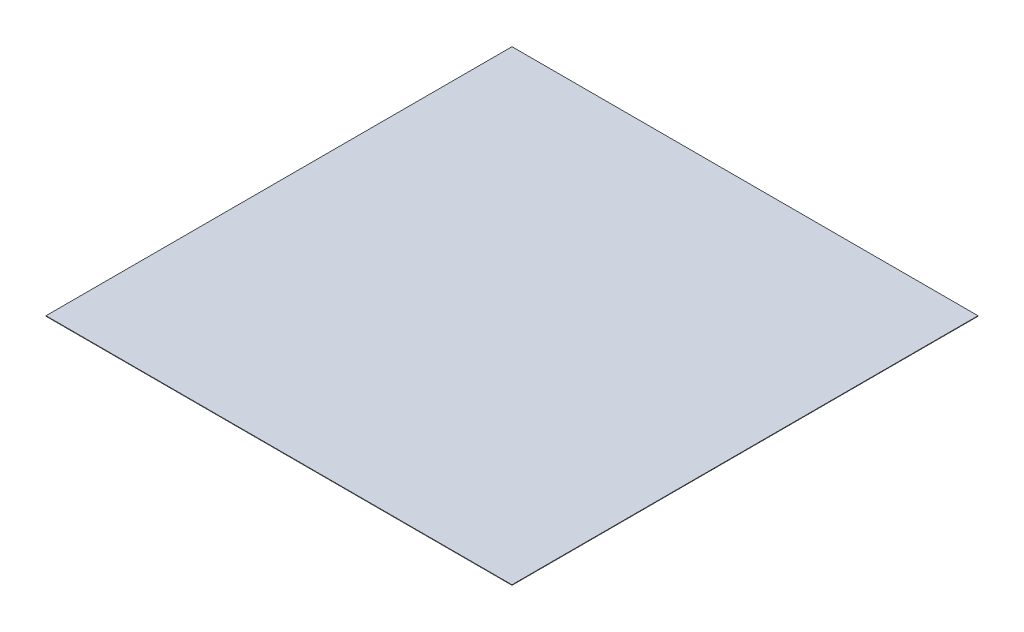
from build123d import *

# Parameters (mm, degrees)
SKETCH1_W           = 1240
SKETCH1_H           = 1240
BOSS_EXTRUDE1_DEPTH = 1.27


with BuildPart() as part:
    # Sketch1 → Boss-Extrude1 (new body)
    with BuildSketch(Plane(origin=(0, 0, 0), x_dir=(1, 0, 0), z_dir=(0, 1, 0))):
        Rectangle(SKETCH1_W, SKETCH1_H)
    extrude(amount=BOSS_EXTRUDE1_DEPTH)


solid = part.part
